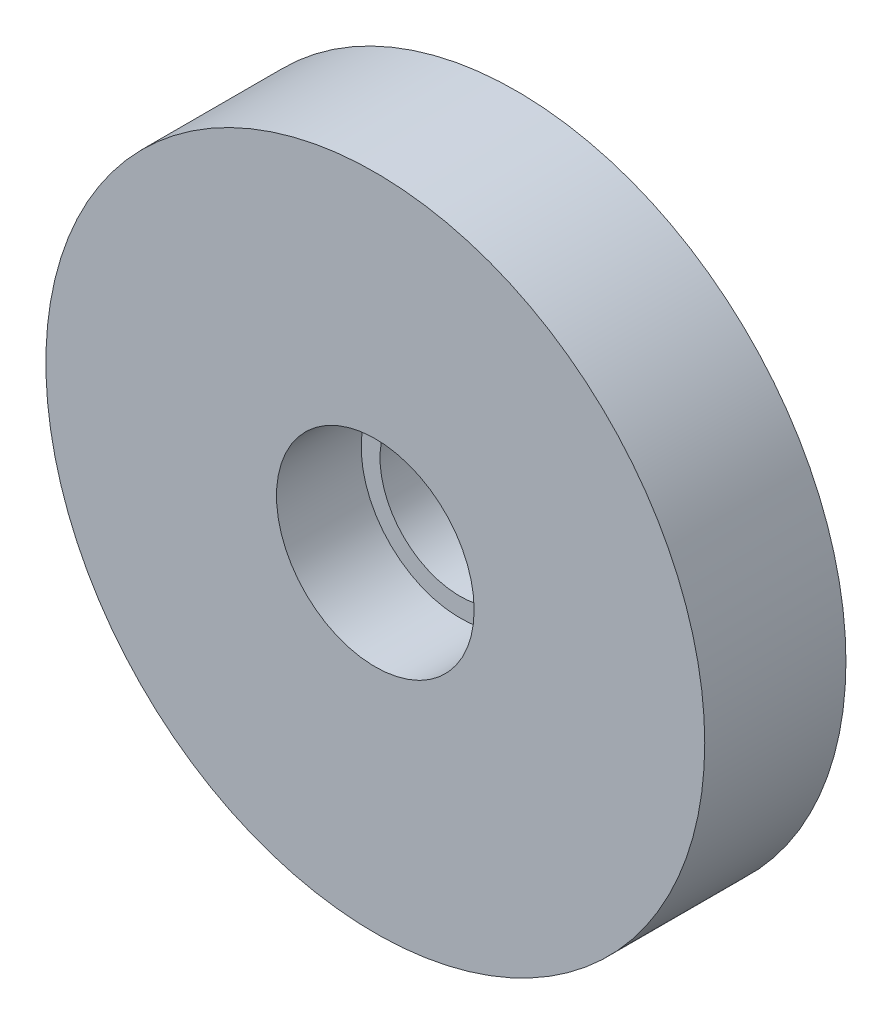
from build123d import *

# Parameters (mm, degrees)
ESQUISSE1_R             = 35
ESQUISSE1_R_2           = 8.5
BOSS_EXTRU_1_DEPTH      = 15
ESQUISSE2_R             = 10.5
ENL_V_MAT_EXTRU_1_DEPTH = 9


with BuildPart() as part:
    # Esquisse1 → Boss.-Extru.1 (new body)
    with BuildSketch(Plane.XY):
        Circle(ESQUISSE1_R)
        Circle(ESQUISSE1_R_2, mode=Mode.SUBTRACT)
    extrude(amount=BOSS_EXTRU_1_DEPTH)

    # Esquisse2 → Enlèv. mat.-Extru.1 (cut)
    with BuildSketch(Plane.XY.offset(15)):
        Circle(ESQUISSE2_R)
    extrude(amount=-ENL_V_MAT_EXTRU_1_DEPTH, mode=Mode.SUBTRACT)


solid = part.part
